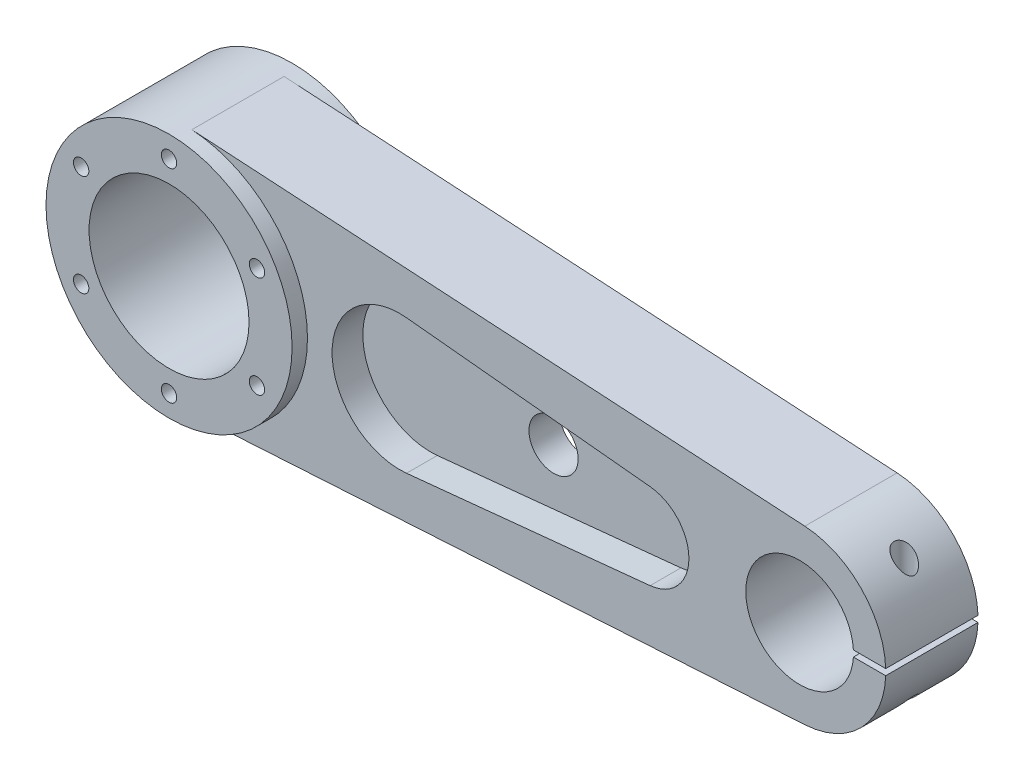
from build123d import *

# Parameters (mm, degrees)
EXTRUDE_1_DEPTH      = 30
SKETCH_2_R           = 40
EXTRUDE_2_DEPTH      = 40
CUT_EXTRUDE_1_DEPTH  = 10
CUT_EXTRUDE_2_DEPTH  = 10
SKETCH_5_R           = 26
CUT_EXTRUDE_3_DEPTH  = 269
SKETCH_6_R           = 17.5
CUT_EXTRUDE_4_DEPTH  = 269
SKETCH_7_R           = 8
CUT_EXTRUDE_5_DEPTH  = 269
SKETCH_9_W           = 30
SKETCH_9_H           = 2
CUT_EXTRUDE_8_DEPTH  = 269
SKETCH_10_R          = 2.5
CUT_EXTRUDE_9_DEPTH  = 12
SKETCH_11_R          = 3.3
CUT_EXTRUDE_10_DEPTH = 268.982


with BuildPart() as part:
    # 草图1 → 凸台-拉伸1 (new body)
    with BuildSketch(Plane.XY.offset(5)):
        with BuildLine():
            Line((2.4, -39.927935083), (201.68, -27.949554558))
            ThreePointArc((201.68, -27.949554558), (228, 0), (201.68, 27.949554558))
            Line((201.68, 27.949554558), (2.4, 39.927935083))
            ThreePointArc((2.4, 39.927935083), (-40, 0), (2.4, -39.927935083))
        make_face()
    extrude(amount=EXTRUDE_1_DEPTH)

    # 草图2 → 凸台-拉伸2 (add)
    with BuildSketch(Plane.XY):
        Circle(SKETCH_2_R)
    extrude(amount=EXTRUDE_2_DEPTH)

    # 草图3 → 切除-拉伸1 (cut)
    with BuildSketch(Plane.XY.offset(25)):
        with BuildLine():
            Line((72.2, -21.889723616), (151.4, -13.929824119))
            ThreePointArc((151.4, -13.929824119), (164, 0), (151.4, 13.929824119))
            Line((151.4, 13.929824119), (72.2, 21.889723616))
            ThreePointArc((72.2, 21.889723616), (48, 0), (72.2, -21.889723616))
        make_face()
    extrude(amount=CUT_EXTRUDE_1_DEPTH, mode=Mode.SUBTRACT)

    # 草图4 → 切除-拉伸2 (cut)
    with BuildSketch(Plane.XY.offset(5)):
        with BuildLine():
            Line((72.2, -21.889723616), (151.4, -13.929824119))
            ThreePointArc((151.4, -13.929824119), (164, 0), (151.4, 13.929824119))
            Line((151.4, 13.929824119), (72.2, 21.889723616))
            ThreePointArc((72.2, 21.889723616), (48, 0), (72.2, -21.889723616))
        make_face()
    extrude(amount=CUT_EXTRUDE_2_DEPTH, mode=Mode.SUBTRACT)

    # 草图5 → 切除-拉伸3 (cut, symmetric)
    with BuildSketch(Plane.XY):
        Circle(SKETCH_5_R)
    extrude(amount=CUT_EXTRUDE_3_DEPTH, both=True, mode=Mode.SUBTRACT)

    # 草图6 → 切除-拉伸4 (cut, symmetric)
    with BuildSketch(Plane.XY):
        with Locations((200, 0)):
            Circle(SKETCH_6_R)
    extrude(amount=CUT_EXTRUDE_4_DEPTH, both=True, mode=Mode.SUBTRACT)

    # 草图7 → 切除-拉伸5 (cut, symmetric)
    with BuildSketch(Plane.XY.offset(15)):
        with Locations((110, 0)):
            Circle(SKETCH_7_R)
    extrude(amount=CUT_EXTRUDE_5_DEPTH, both=True, mode=Mode.SUBTRACT)

    # 草图9 → 切除-拉伸8 (cut, symmetric)
    with BuildSketch(Plane.XY.offset(20)):
        with Locations((215, 0)):
            Rectangle(SKETCH_9_W, SKETCH_9_H)
    extrude(amount=CUT_EXTRUDE_8_DEPTH, both=True, mode=Mode.SUBTRACT)

    # 草图10 → 切除-拉伸9 (cut)
    with BuildSketch(Plane.XY.offset(40)):
        with Locations((28.5788, 16.5)):
            Circle(SKETCH_10_R)
        with Locations((0, 33)):
            Circle(SKETCH_10_R)
        with Locations((-28.5788, 16.5)):
            Circle(SKETCH_10_R)
        with Locations((-28.5788, -16.5)):
            Circle(SKETCH_10_R)
        with Locations((0, -33)):
            Circle(SKETCH_10_R)
        with Locations((28.5788, -16.5)):
            Circle(SKETCH_10_R)
    extrude(amount=-CUT_EXTRUDE_9_DEPTH, mode=Mode.SUBTRACT)

    # 草图11 → 切除-拉伸10 (cut, symmetric)
    with BuildSketch(Plane(origin=(0, 0, 0), x_dir=(1, 0, 0), z_dir=(0, 1, 0))):
        with Locations(Location((219, -20, 0), (0, 0, 270))):
            Circle(SKETCH_11_R)
    extrude(amount=CUT_EXTRUDE_10_DEPTH, both=True, mode=Mode.SUBTRACT)


solid = part.part
